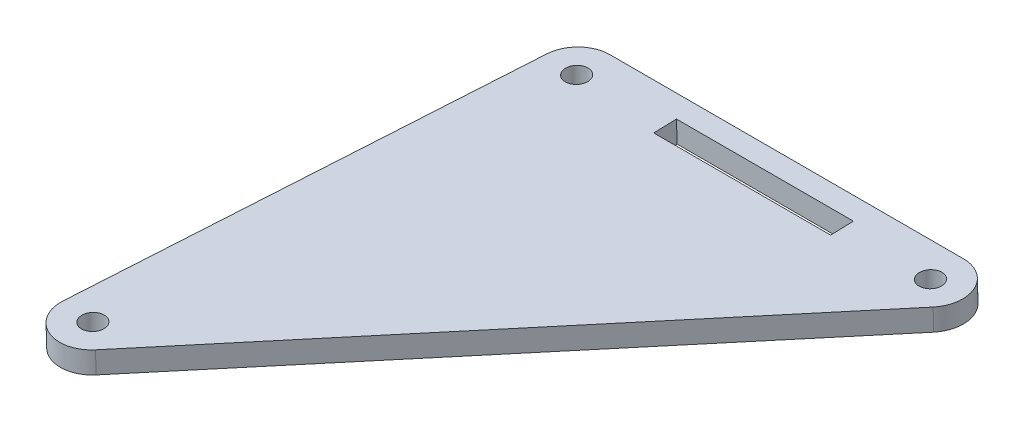
from build123d import *

# Parameters (mm, degrees)
SKETCH1_R           = 3.2639
BOSS_EXTRUDE1_DEPTH = 6.35
SKETCH2_W           = 50.8
SKETCH2_H           = 6.5278
CUT_EXTRUDE1_DEPTH  = 633.86660682


with BuildPart() as part:
    # Sketch1 → Boss-Extrude1 (new body)
    with BuildSketch(Plane(origin=(0, 345.441352572, 10.725757471), x_dir=(1, 0, 0), z_dir=(0, 0.9995183146693659, 0.0310344750319807))):
        with BuildLine():
            Line((-170.726579561, 560.338454563), (-272.326579561, 560.338454563))
            ThreePointArc((-272.326579561, 560.338454563), (-278.738498836, 557.857098237), (-281.809681848, 551.705864791))
            Line((-281.809681848, 551.705864791), (-293.761055515, 424.705864791))
            ThreePointArc((-293.761055515, 424.705864791), (-288.089455083, 415.084303481), (-277.177301788, 417.464724444))
            Line((-277.177301788, 417.464724444), (-163.62592812, 544.464724444))
            ThreePointArc((-163.62592812, 544.464724444), (-162.031831739, 554.702797092), (-170.726579561, 560.338454563))
        make_face()
        with Locations(Location((-284.277953229, 423.813454563, 0), (0, 0, 270))):
            Circle(SKETCH1_R, mode=Mode.SUBTRACT)
        with Locations(Location((-272.326579561, 550.813454563, 0), (0, 0, 270))):
            Circle(SKETCH1_R, mode=Mode.SUBTRACT)
        with Locations(Location((-170.726579561, 550.813454563, 0), (0, 0, 270))):
            Circle(SKETCH1_R, mode=Mode.SUBTRACT)
    extrude(amount=BOSS_EXTRUDE1_DEPTH)

    # Sketch2 → Cut-Extrude1 (cut, through all)
    with BuildSketch(Plane(origin=(0, 351.78829387, 10.922826388), x_dir=(1, 0, 0), z_dir=(0, 0.9995183146693659, 0.03103447503198071))):
        with Locations((-221.526579561, 550.813454563)):
            Rectangle(SKETCH2_W, SKETCH2_H)
    extrude(amount=-CUT_EXTRUDE1_DEPTH, mode=Mode.SUBTRACT)


solid = part.part
